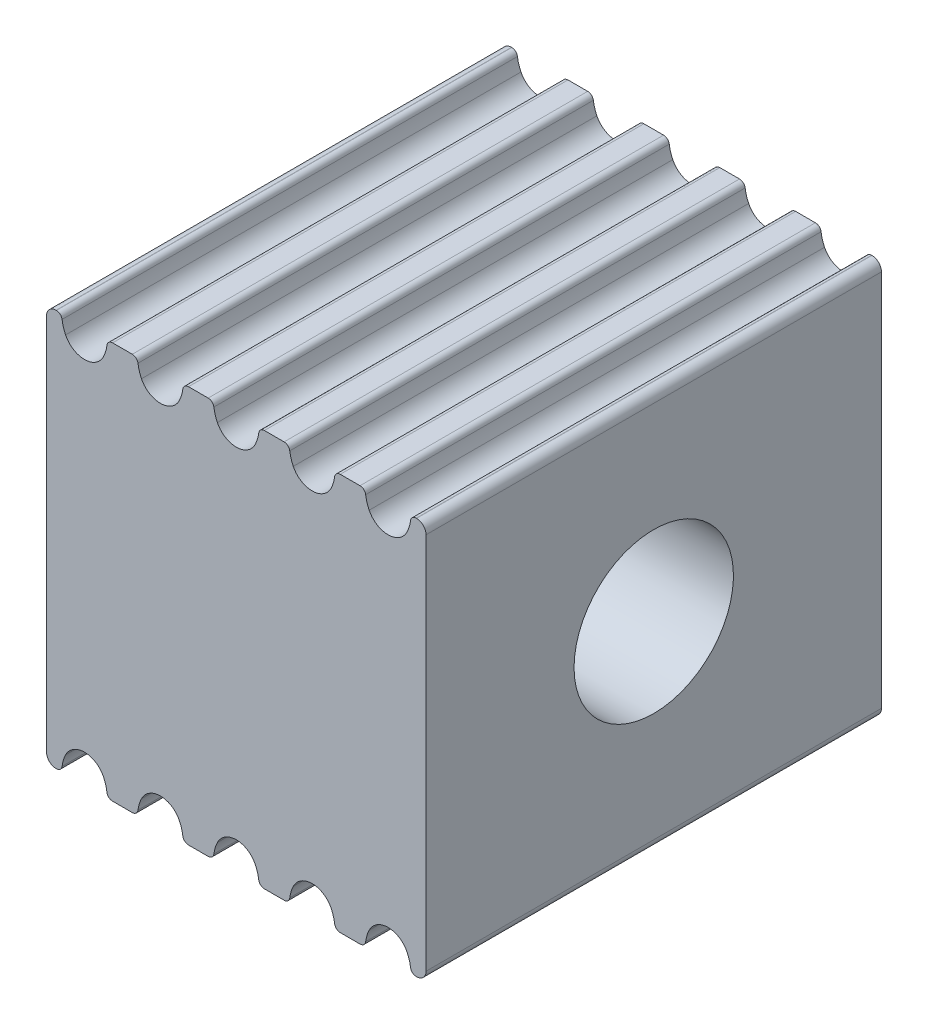
from build123d import *

# Parameters (mm, degrees)
BOSS_EXTRUDE1_DEPTH             = 6.35
LPATTERN1_COUNT                 = 5
LPATTERN1_PITCH                 = 2
SKETCH4_W                       = 10
SKETCH4_H                       = 6
BOSS_EXTRUDE3_DEPTH             = 6
FILLET1_R                       = 0.25
M5X0_8_TAPPED_HOLE1_D           = 4.2
M5X0_8_TAPPED_HOLE1_CSINK_D     = 5.05
M5X0_8_TAPPED_HOLE1_CSINK_ANGLE = 90


with BuildPart() as part:
    # Sketch1 → Boss-Extrude1 (new, symmetric)
    with BuildSketch(Plane.XY):
        with BuildLine():
            Line((0, 0), (0, -0.254))
            Line((0, -0.254), (0.259824575, -0.254))
            ThreePointArc((0.259824575, -0.254), (0.358731646, -0.291228588), (0.408543109, -0.384434783))
            ThreePointArc((0.408543109, -0.384434783), (0.442388286, -0.542062154), (0.501123596, -0.692202247))
            ThreePointArc((0.501123596, -0.692202247), (0.705850588, -0.919639059), (1, -1.004))
            Line((1, -1.004), (1, 0))
            Line((1, 0), (1, 0.516))
            Line((1, 0.516), (0, 0.516))
            Line((0, 0.516), (0, 0))
        make_face()
    extrude(amount=BOSS_EXTRUDE1_DEPTH, both=True)

    # Mirror1: part across plane


with BuildPart() as part_1:
    add(part.part)
    add(part.part.mirror(Plane(origin=(1, 0.516, 6.35), x_dir=(0, 0, 1), z_dir=(-1, 0, 0))))


with BuildPart() as lpattern1_1:
    # LPattern1: pattern copy
    add(part_1.part.moved(Location(Vector(-1, 0, 0) * (1 * LPATTERN1_PITCH))))


with BuildPart() as lpattern1_2:
    # LPattern1: pattern copy
    add(part_1.part.moved(Location(Vector(-1, 0, 0) * (2 * LPATTERN1_PITCH))))


with BuildPart() as lpattern1_3:
    # LPattern1: pattern copy
    add(part_1.part.moved(Location(Vector(-1, 0, 0) * (3 * LPATTERN1_PITCH))))


with BuildPart() as lpattern1_4:
    # LPattern1: pattern copy
    add(part_1.part.moved(Location(Vector(-1, 0, 0) * (4 * LPATTERN1_PITCH))))


with BuildPart() as lpattern1_1_1:
    add(lpattern1_1.part)

    # Combine1: union LPattern1_4, part, LPattern1_3, LPattern1_2
    add(lpattern1_4.part)
    add(part_1.part)
    add(lpattern1_3.part)
    add(lpattern1_2.part)


with BuildPart() as body_2:
    # Sketch4 → Boss-Extrude3 (new, symmetric)
    with BuildSketch(Plane.XY):
        with Locations((-3, -2.484)):
            Rectangle(SKETCH4_W, SKETCH4_H)
    extrude(amount=BOSS_EXTRUDE3_DEPTH, both=True)

    # Combine2: cut LPattern1_1
    add(lpattern1_1_1.part, mode=Mode.SUBTRACT)

    # Mirror2: body 2 across plane


with BuildPart() as body_2_1:
    add(body_2.part)
    add(body_2.part.mirror(Plane(origin=(2, -5.484, 6), x_dir=(0, 0, 1), z_dir=(0, 1, 0))))

    # Fillet1
    fillet1_edges = [body_2_1.edges().sort_by_distance(p)[0] for p in [
        (2, -10.714, 0),
        (-8, -10.714, 0),
        (-8, -0.254, 0),
        (2, -0.254, 0),
    ]]
    fillet(fillet1_edges, radius=FILLET1_R)

    # M5x0.8 Tapped Hole1 (through all)
    with Locations(Plane.ZY.offset(8)):
        with Locations((0, -5.484)):
            CounterSinkHole(M5X0_8_TAPPED_HOLE1_D / 2, M5X0_8_TAPPED_HOLE1_CSINK_D / 2, counter_sink_angle=M5X0_8_TAPPED_HOLE1_CSINK_ANGLE)


solid = body_2_1.part
